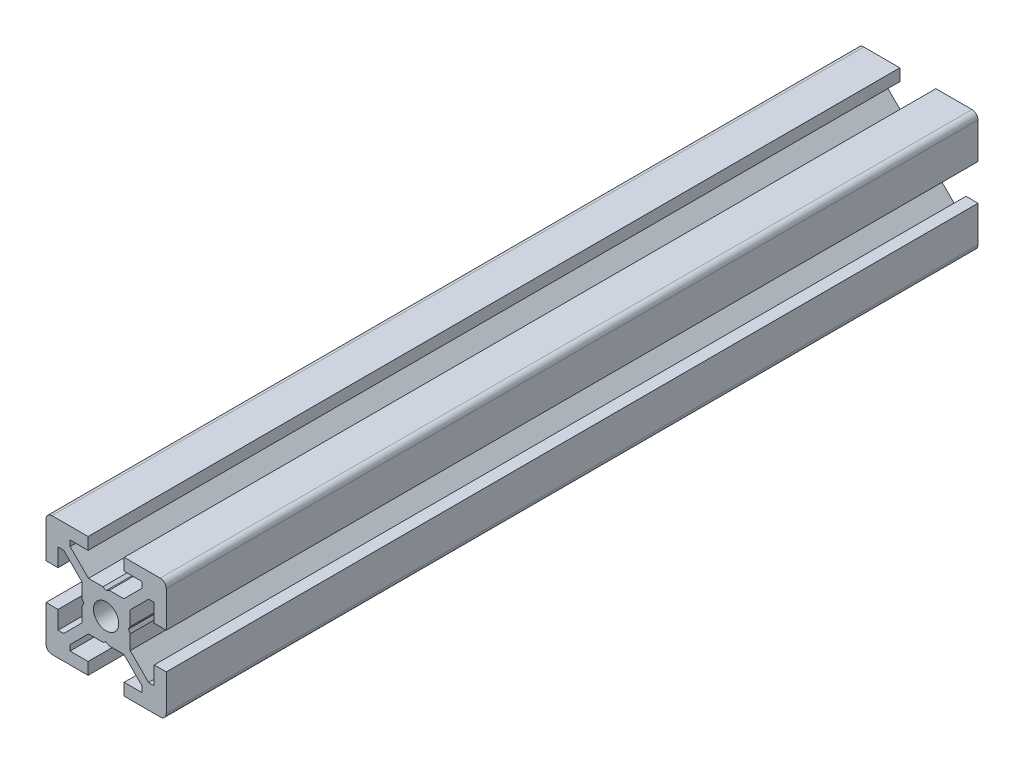
from build123d import *

# Parameters (mm, degrees)
BOSS_EXTRUDE1_DEPTH = 135
SKETCH2_W           = 135
SKETCH2_H           = 2.1


with BuildPart() as part:
    # Sketch1 → Boss-Extrude1 (new body)
    with BuildSketch(Plane.XY):
        with BuildLine():
            Line((-10, -3), (-10, -9))
            ThreePointArc((-10, -9), (-9.707106781, -9.707106781), (-9, -10))
            Line((-9, -10), (-3, -10))
            Line((-3, -10), (-3, -8))
            Line((-3, -8), (-6, -8))
            Line((-6, -8), (-6, -7.060660172))
            Line((-6, -7.060660172), (-2.939339828, -4))
            Line((-2.939339828, -4), (-0.519615242, -4))
            Line((-0.519615242, -4), (0, -3.7))
            Line((0, -3.7), (0.519615242, -4))
            Line((0.519615242, -4), (2.939339828, -4))
            Line((2.939339828, -4), (6, -7.060660172))
            Line((6, -7.060660172), (6, -8))
            Line((6, -8), (3, -8))
            Line((3, -8), (3, -10))
            Line((3, -10), (9, -10))
            ThreePointArc((9, -10), (9.707106781, -9.707106781), (10, -9))
            Line((10, -9), (10, -3))
            Line((10, -3), (8, -3))
            Line((8, -3), (8, -6))
            Line((8, -6), (7.060660172, -6))
            Line((7.060660172, -6), (4, -2.939339828))
            Line((4, -2.939339828), (4, -0.519615242))
            Line((4, -0.519615242), (3.7, 0))
            Line((3.7, 0), (4, 0.519615242))
            Line((4, 0.519615242), (4, 2.939339828))
            Line((4, 2.939339828), (7.060660172, 6))
            Line((7.060660172, 6), (8, 6))
            Line((8, 6), (8, 3))
            Line((8, 3), (10, 3))
            Line((10, 3), (10, 9))
            ThreePointArc((10, 9), (9.707106781, 9.707106781), (9, 10))
            Line((9, 10), (3, 10))
            Line((3, 10), (3, 8))
            Line((3, 8), (6, 8))
            Line((6, 8), (6, 7.060660172))
            Line((6, 7.060660172), (2.939339828, 4))
            Line((2.939339828, 4), (0.519615242, 4))
            Line((0.519615242, 4), (0, 3.7))
            Line((0, 3.7), (-0.519615242, 4))
            Line((-0.519615242, 4), (-2.939339828, 4))
            Line((-2.939339828, 4), (-6, 7.060660172))
            Line((-6, 7.060660172), (-6, 8))
            Line((-6, 8), (-3, 8))
            Line((-3, 8), (-3, 10))
            Line((-3, 10), (-9, 10))
            ThreePointArc((-9, 10), (-9.707106781, 9.707106781), (-10, 9))
            Line((-10, 9), (-10, 3))
            Line((-10, 3), (-8, 3))
            Line((-8, 3), (-8, 6))
            Line((-8, 6), (-7.060660172, 6))
            Line((-7.060660172, 6), (-4, 2.939339828))
            Line((-4, 2.939339828), (-4, 0.519615242))
            Line((-4, 0.519615242), (-3.7, 0))
            Line((-3.7, 0), (-4, -0.519615242))
            Line((-4, -0.519615242), (-4, -2.939339828))
            Line((-4, -2.939339828), (-7.060660172, -6))
            Line((-7.060660172, -6), (-8, -6))
            Line((-8, -6), (-8, -3))
            Line((-8, -3), (-10, -3))
        make_face()
    extrude(amount=-BOSS_EXTRUDE1_DEPTH)

    # Sketch2 → Cut-Revolve1 (revolve, cut)
    with BuildSketch(Plane(origin=(0, 0, 0), x_dir=(0, 0, -1), z_dir=(1, 0, 0)), mode=Mode.PRIVATE) as cut_revolve1_sk:
        with Locations((67.5, 1.05)):
            Rectangle(SKETCH2_W, SKETCH2_H)
    revolve(cut_revolve1_sk.sketch.rotate(Axis((0, 0, -135), (0, 0, 1)), 270), axis=Axis((0, 0, -135), (0, 0, 1)), mode=Mode.SUBTRACT)


solid = part.part
